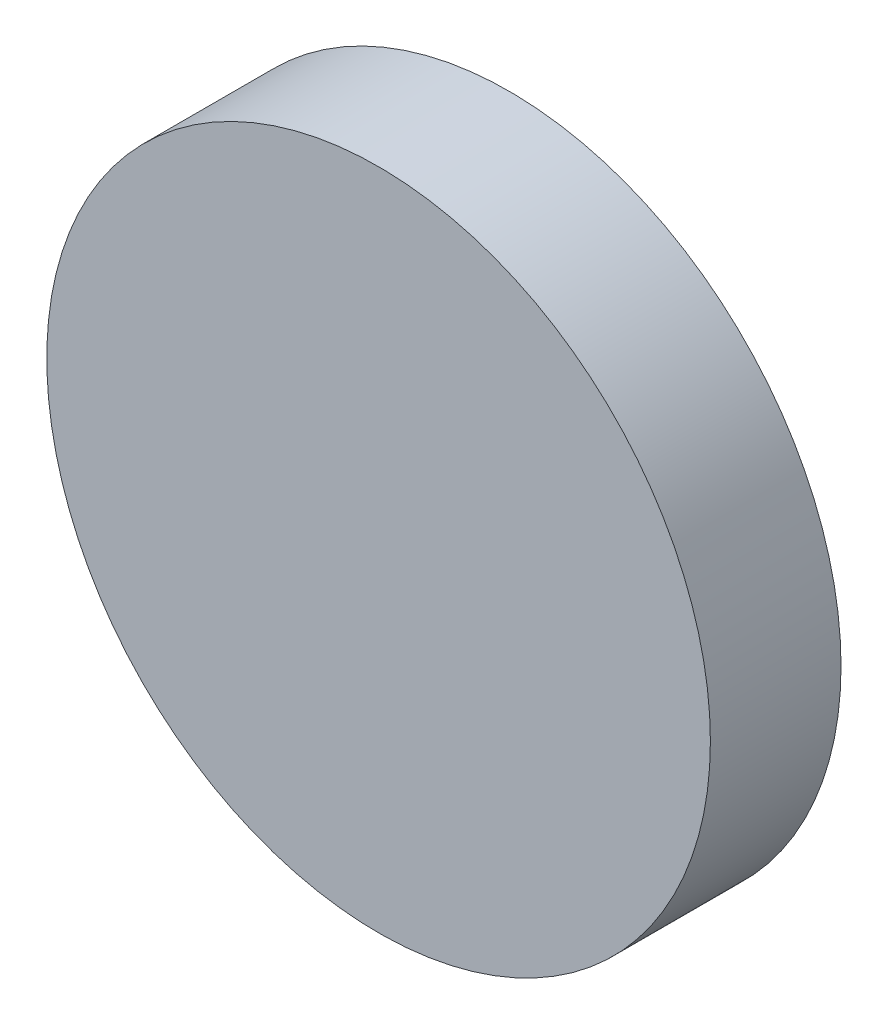
from build123d import *

# Parameters (mm, degrees)
SKETCH1_R           = 76.2
BOSS_EXTRUDE1_DEPTH = 30


with BuildPart() as part:
    # Sketch1 → Boss-Extrude1 (new body)
    with BuildSketch(Plane.XY):
        with Locations((-19.878685886, 7.256330124)):
            Circle(SKETCH1_R)
    extrude(amount=BOSS_EXTRUDE1_DEPTH)


solid = part.part
